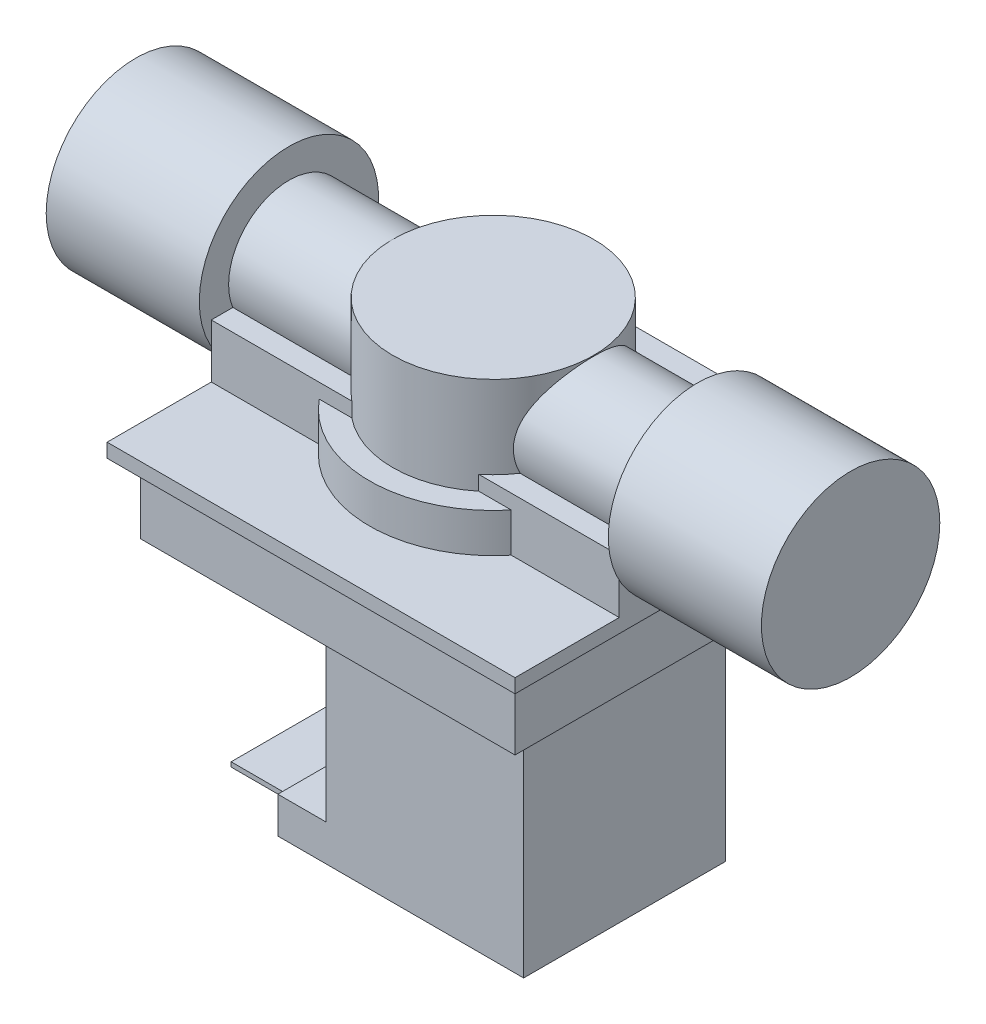
from build123d import *

# Parameters (mm, degrees)
SKETCH1_W                = 48.1838
SKETCH1_H                = 43.0276
BOSS_EXTRUDE1_DEPTH      = 9.8806
SKETCH2_W                = 1.9685
SKETCH2_H                = 8.2296
CUT_EXTRUDE1_DEPTH       = 66.350433821
SKETCH4_W                = 1.9685
SKETCH4_H                = 8.2296
CUT_EXTRUDE2_DEPTH       = 65.071479861
SKETCH7_W                = 2.93146275
SKETCH7_H                = 2.802785647
BOSS_EXTRUDE2_DEPTH      = 8.89
BOSS_EXTRUDE3_DEPTH      = 24.13
BOSS_EXTRUDE3_DEPTH_BACK = 24.13
SKETCH8_R                = 7.1247
SKETCH9_W                = 48.1838
SKETCH9_H                = 18.415
BOSS_EXTRUDE4_DEPTH      = 6.35
SKETCH10_R               = 10.536568217
BOSS_EXTRUDE5_DEPTH      = 18.0848
SKETCH11_R               = 10.588095361
BOSS_EXTRUDE6_DEPTH      = 18.0848
SKETCH12_W               = 3.635847489
SKETCH12_H               = 2.34172836
CUT_EXTRUDE3_DEPTH       = 79.754744187
SKETCH14_W               = 3.684147677
SKETCH14_H               = 13.068356619
CUT_EXTRUDE4_DEPTH       = 79.754744187
SKETCH15_R               = 14.605
BOSS_EXTRUDE7_DEPTH      = 4.6228
SKETCH16_R               = 11.8745
BOSS_EXTRUDE8_DEPTH      = 11.4808
SKETCH18_R               = 2.159
CUT_EXTRUDE5_DEPTH       = 11.4808
SKETCH19_W               = 29.0322
SKETCH19_H               = 23.8252
BOSS_EXTRUDE9_DEPTH      = 29.972
SKETCH20_W               = 5.701054359
SKETCH20_H               = 24.361747341
CUT_EXTRUDE6_DEPTH       = 29.972
SKETCH21_W               = 19.733319163
SKETCH21_H               = 0.544777799
BOSS_EXTRUDE10_DEPTH     = 7.62


with BuildPart() as part:
    # Sketch1 → Boss-Extrude1 (new body)
    with BuildSketch(Plane(origin=(0, 0, 0), x_dir=(1, 0, 0), z_dir=(0, 1, 0))):
        with Locations((24.0919, 21.5138)):
            Rectangle(SKETCH1_W, SKETCH1_H)
    extrude(amount=BOSS_EXTRUDE1_DEPTH)

    # Sketch2 → Cut-Extrude1 (cut, through all)
    with BuildSketch(Plane(origin=(48.1838, 0, 0), x_dir=(0, 0, -1), z_dir=(1, 0, 0))):
        with Locations((42.04335, 4.1148)):
            Rectangle(SKETCH2_W, SKETCH2_H)
        with Locations((0.98425, 4.1148)):
            Rectangle(SKETCH2_W, SKETCH2_H)
    extrude(amount=-CUT_EXTRUDE1_DEPTH, mode=Mode.SUBTRACT)

    # Sketch4 → Cut-Extrude2 (cut, through all)
    with BuildSketch(Plane.XY.offset(-1.9685)):
        with Locations((0.98425, 4.1148)):
            Rectangle(SKETCH4_W, SKETCH4_H)
        with Locations((47.19955, 4.1148)):
            Rectangle(SKETCH4_W, SKETCH4_H)
    extrude(amount=-CUT_EXTRUDE2_DEPTH, mode=Mode.SUBTRACT)

    # Sketch7 → Boss-Extrude2 (add)
    with BuildSketch(Plane(origin=(0, 9.8806, 0), x_dir=(1, 0, 0), z_dir=(0, 1, 0))):
        with Locations((25.557631375, 20.112407176)):
            Rectangle(SKETCH7_W, SKETCH7_H)
    extrude(amount=BOSS_EXTRUDE2_DEPTH)

    # Sketch8 → Boss-Extrude3 (add, two sides: drawn at the far end of the back side and taken through both)
    with BuildSketch(Plane.ZY.offset(-24.0919).offset(-BOSS_EXTRUDE3_DEPTH_BACK)):
        with Locations((-21.5138, 18.7706)):
            Circle(SKETCH8_R)
    extrude(amount=BOSS_EXTRUDE3_DEPTH + BOSS_EXTRUDE3_DEPTH_BACK)

    # Sketch9 → Boss-Extrude4 (add)
    with BuildSketch(Plane(origin=(0, 9.8806, 0), x_dir=(1, 0, 0), z_dir=(0, 1, 0))):
        with Locations((24.0919, 21.5138)):
            Rectangle(SKETCH9_W, SKETCH9_H)
    extrude(amount=BOSS_EXTRUDE4_DEPTH)

    # Sketch10 → Boss-Extrude5 (add)
    with BuildSketch(Plane(origin=(48.2219, 0, 0), x_dir=(0, 0, -1), z_dir=(1, 0, 0))):
        with Locations((21.5138, 18.7706)):
            Circle(SKETCH10_R)
    extrude(amount=BOSS_EXTRUDE5_DEPTH)

    # Sketch11 → Boss-Extrude6 (add)
    with BuildSketch(Plane.ZY.offset(0.0381)):
        with Locations((-21.5138, 18.7706)):
            Circle(SKETCH11_R)
    extrude(amount=BOSS_EXTRUDE6_DEPTH)

    # Sketch12 → Cut-Extrude3 (cut, through all)
    with BuildSketch(Plane.XY.offset(-12.3063)):
        with Locations((25.909823745, 11.05146418)):
            Rectangle(SKETCH12_W, SKETCH12_H)
    extrude(amount=-CUT_EXTRUDE3_DEPTH, mode=Mode.SUBTRACT)

    # Sketch14 → Cut-Extrude4 (cut, through all)
    with BuildSketch(Plane.XY.offset(-12.3063)):
        with Locations((25.933973839, 18.75650667)):
            Rectangle(SKETCH14_W, SKETCH14_H)
    extrude(amount=-CUT_EXTRUDE4_DEPTH, mode=Mode.SUBTRACT)

    # Sketch15 → Boss-Extrude7 (add)
    with BuildSketch(Plane(origin=(0, 9.8806, 0), x_dir=(1, 0, 0), z_dir=(0, 1, 0))):
        with Locations((24.0919, 21.5138)):
            Circle(SKETCH15_R)
    extrude(amount=BOSS_EXTRUDE7_DEPTH)

    # Sketch16 → Boss-Extrude8 (add)
    with BuildSketch(Plane(origin=(0, 14.5034, 0), x_dir=(1, 0, 0), z_dir=(0, 1, 0))):
        with Locations(Location((24.0919, 21.5138, 0), (0, 0, 50.84140908))):
            Circle(SKETCH16_R)
    extrude(amount=BOSS_EXTRUDE8_DEPTH)

    # Sketch18 → Cut-Extrude5 (cut)
    with BuildSketch(Plane(origin=(0, 9.8806, 0), x_dir=(1, 0, 0), z_dir=(0, 1, 0))):
        with Locations(Location((42.7228, 37.5666, 0), (0, 0, 270))):
            Circle(SKETCH18_R)
    extrude(amount=-CUT_EXTRUDE5_DEPTH, mode=Mode.SUBTRACT)

    # Sketch19 → Boss-Extrude9 (add)
    with BuildSketch(Plane.XZ):
        with Locations((25.0444, -21.5519)):
            Rectangle(SKETCH19_W, SKETCH19_H)
    extrude(amount=BOSS_EXTRUDE9_DEPTH)

    # Sketch20 → Cut-Extrude6 (cut)
    with BuildSketch(Plane.XY.offset(-9.6393)):
        with Locations((13.378827179, -13.505025304)):
            Rectangle(SKETCH20_W, SKETCH20_H)
    extrude(amount=-CUT_EXTRUDE6_DEPTH, mode=Mode.SUBTRACT)

    # Sketch21 → Boss-Extrude10 (add)
    with BuildSketch(Plane.ZY.offset(-10.5283)):
        with Locations((-21.607385296, -27.502260314)):
            Rectangle(SKETCH21_W, SKETCH21_H)
    extrude(amount=BOSS_EXTRUDE10_DEPTH)


solid = part.part
